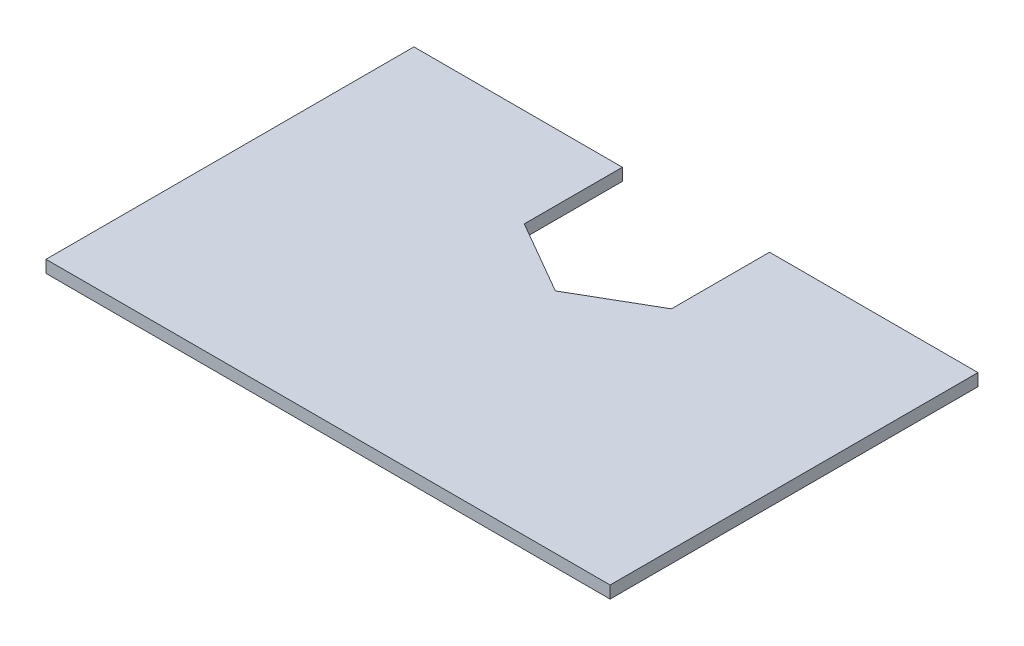
from build123d import *

# Parameters (mm, degrees)
SKETCH1_W           = 230
SKETCH1_H           = 150
BOSS_EXTRUDE1_DEPTH = 5
CUT_EXTRUDE1_DEPTH  = 275.636122897


with BuildPart() as part:
    # Sketch1 → Boss-Extrude1 (new body)
    with BuildSketch(Plane(origin=(0, 0, 0), x_dir=(1, 0, 0), z_dir=(0, 1, 0))):
        with Locations((115, -75)):
            Rectangle(SKETCH1_W, SKETCH1_H)
    extrude(amount=BOSS_EXTRUDE1_DEPTH)

    # Sketch2 → Cut-Extrude1 (cut, through all)
    with BuildSketch(Plane(origin=(0, 5, 0), x_dir=(1, 0, 0), z_dir=(0, 1, 0))):
        Polygon((145, 0), (85, 0), (85, -40), (115, -57.320508076), (145, -40), align=None)
    extrude(amount=-CUT_EXTRUDE1_DEPTH, mode=Mode.SUBTRACT)


solid = part.part
